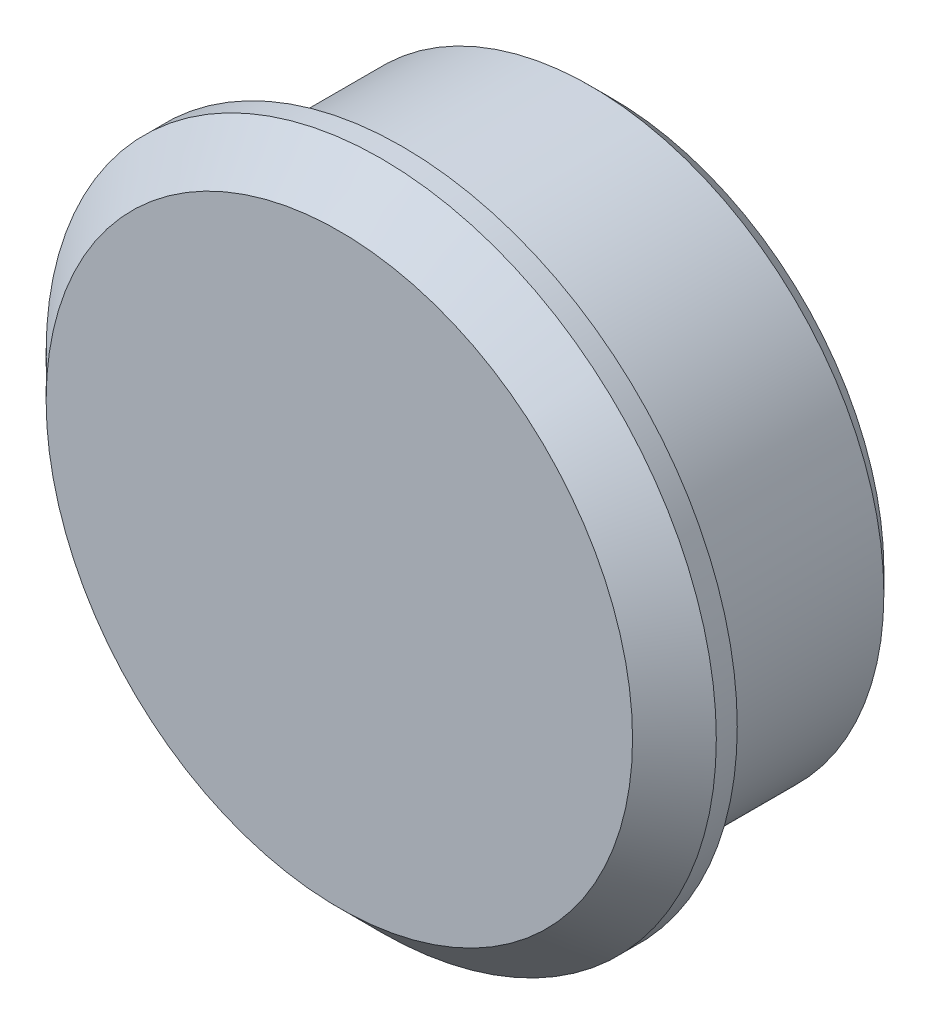
from build123d import *


with BuildPart() as part:
    # Sketch1 → Revolve1 (revolve)
    with BuildSketch(Plane(origin=(0, 0, 0), x_dir=(0, 0, -1), z_dir=(1, 0, 0)), mode=Mode.PRIVATE) as revolve1_sk:
        Polygon((0, 0), (0, 14), (2, 16), (3, 16), (3, 14), (12, 14), (13, 13), (13, 11), (3, 11), (3, 0), align=None)
    revolve(revolve1_sk.sketch.rotate(Axis((0, 0, 0), (0, 0, -1)), 90), axis=Axis((0, 0, 0), (0, 0, -1)))


solid = part.part
